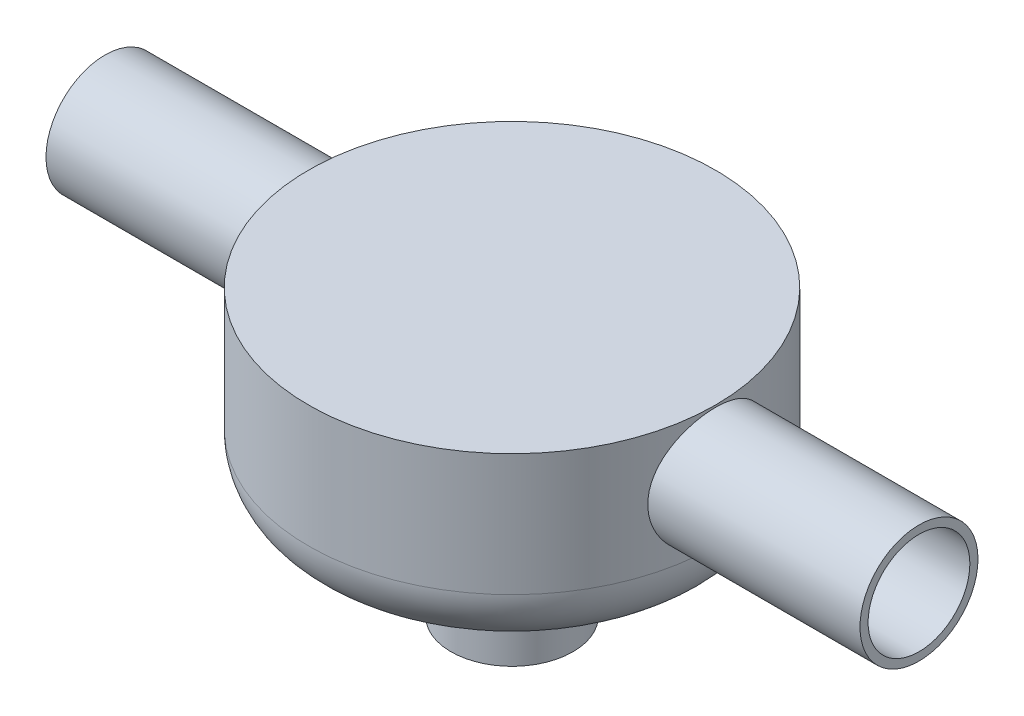
from build123d import *

# Parameters (mm, degrees)
CUT_EXTRUDE1_DEPTH       = 97.046863666
CUT_EXTRUDE1_DEPTH_BACK  = 97.046863666
SKETCH2_R                = 12.5
EXTRUDE_THIN1_REACH      = 172.953
EXTRUDE_THIN1_END_RADIUS = 50
SKETCH12_R               = 14.5
SKETCH12_R_2             = 12.5


with BuildPart() as part:
    # Sketch1 → Revolve1 (revolve)
    with BuildSketch(Plane.XY):
        with BuildLine():
            Line((0, 65), (50, 65))
            Line((50, 65), (50, 35))
            ThreePointArc((50, 35), (45.606601718, 24.393398282), (35, 20))
            Line((35, 20), (15, 20))
            Line((15, 20), (15, -5))
            Line((15, -5), (13, -5))
            Line((13, -5), (13, 22))
            Line((13, 22), (33, 22))
            ThreePointArc((33, 22), (43.606601718, 26.393398282), (48, 37))
            Line((48, 37), (48, 63))
            Line((48, 63), (0, 63))
            Line((0, 63), (0, 65))
        make_face()
    revolve(axis=Axis((0, 0, 0), (0, 1, 0)))

    # Sketch2 → Cut-Extrude1 (cut, two sides: drawn at the far end of the back side and taken through both)
    with BuildSketch(Plane(origin=(0, 0, 0), x_dir=(0, 0, -1), z_dir=(1, 0, 0)).offset(-CUT_EXTRUDE1_DEPTH_BACK)):
        with Locations((0, 50)):
            Circle(SKETCH2_R)
    extrude(amount=CUT_EXTRUDE1_DEPTH + CUT_EXTRUDE1_DEPTH_BACK, mode=Mode.SUBTRACT)

    # Extrude-Thin1: up to this cylinder (the profile starts outside it)
    extrude_thin1_end = Plane(origin=(0, 50, 0), z_dir=(0, -1, 0)) * Cylinder(EXTRUDE_THIN1_END_RADIUS, 446.906, mode=Mode.PRIVATE)
    # Sketch12 → Extrude-Thin1 (add, up to the surface)
    with BuildSketch(Plane(origin=(100, 0, 0), x_dir=(0, 0, -1), z_dir=(1, 0, 0)), mode=Mode.PRIVATE) as extrude_thin1_sk1:
        with Locations((0, 50)):
            Circle(SKETCH12_R)
        with Locations((0, 50)):
            Circle(SKETCH12_R_2, mode=Mode.SUBTRACT)
    extrude_thin1_tool1 = extrude(extrude_thin1_sk1.sketch, amount=-EXTRUDE_THIN1_REACH, mode=Mode.PRIVATE) - extrude_thin1_end
    extrude_thin1 = extrude_thin1_tool1.solids().sort_by_distance((100, 50, 14.089878))[0]
    add(extrude_thin1)

    # Mirror1: Extrude-Thin1 across plane
    add(extrude_thin1.mirror(Plane(origin=(0, 0, 0), x_dir=(0, 0, 1), z_dir=(1, 0, 0))))


solid = part.part
